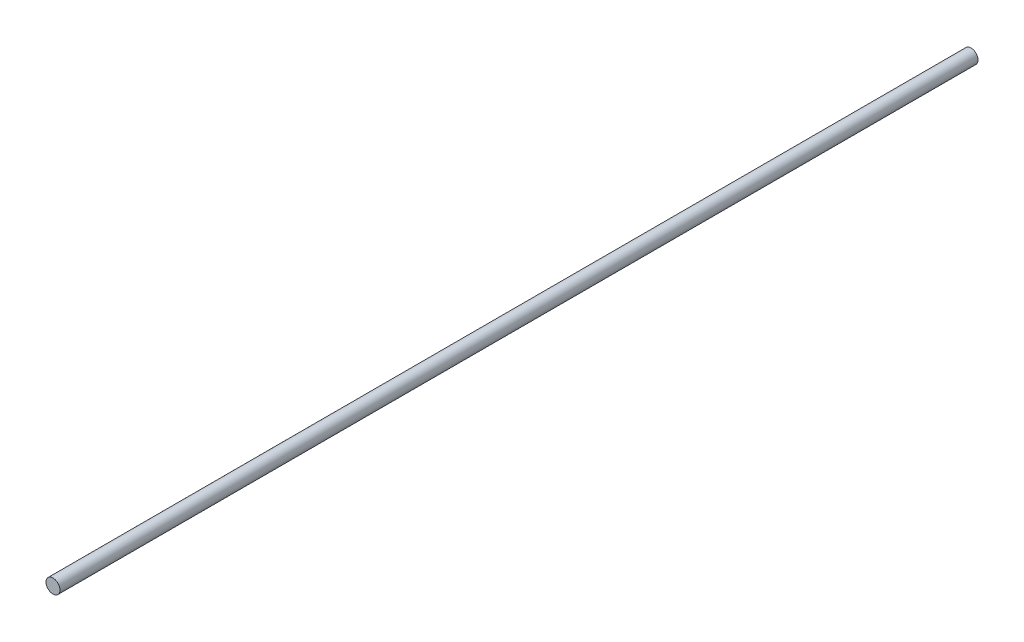
from build123d import *

# Parameters (mm, degrees)
ESQUISSE1_R        = 5
BOSS_EXTRU_1_DEPTH = 658


with BuildPart() as part:
    # Esquisse1 → Boss.-Extru.1 (new body)
    with BuildSketch(Plane.XY):
        Circle(ESQUISSE1_R)
    extrude(amount=BOSS_EXTRU_1_DEPTH)


solid = part.part
